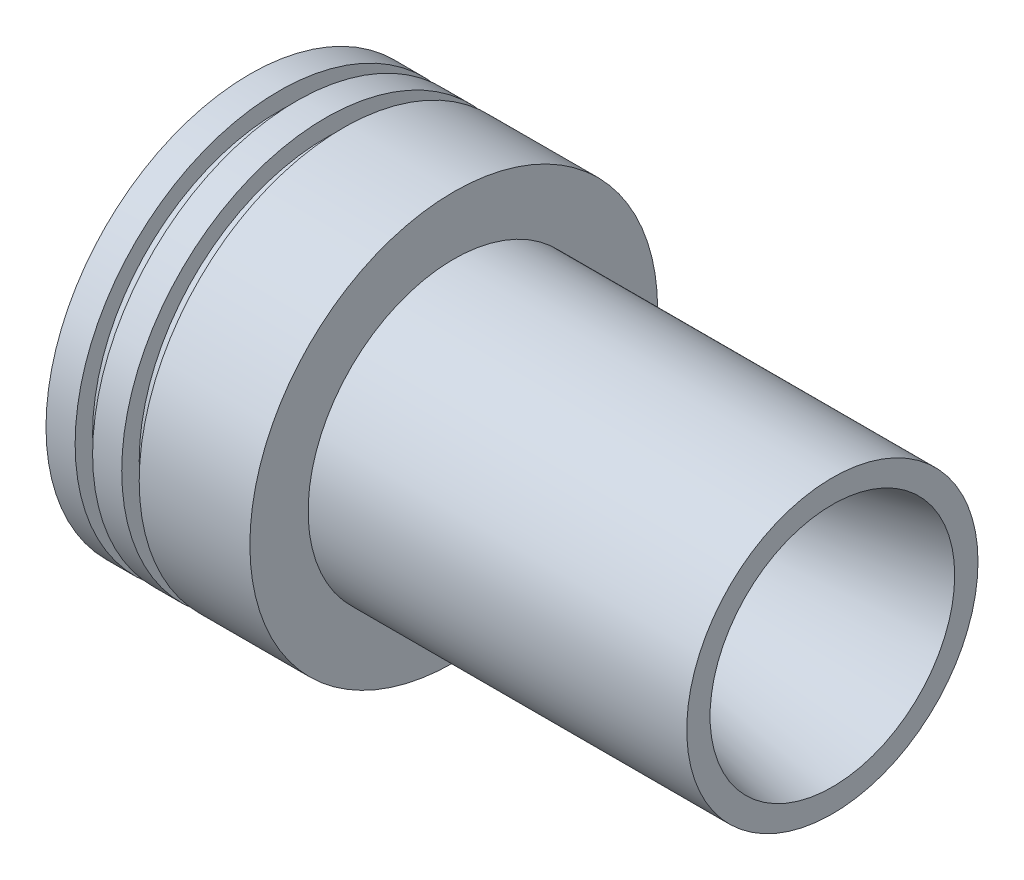
from build123d import *

# Parameters (mm, degrees)
SKETCH1_R           = 35
BOSS_EXTRUDE1_DEPTH = 35
SKETCH2_R           = 25
BOSS_EXTRUDE2_DEPTH = 65
SKETCH5_R           = 26
SKETCH7_R           = 6.5
SKETCH6_R           = 21
SKETCH8_R           = 6.5
SKETCH13_R          = 6.5
CUT_EXTRUDE2_DEPTH  = 100


with BuildPart() as part:
    # Sketch1 → Boss-Extrude1 (new body)
    with BuildSketch(Plane(origin=(0, 0, 0), x_dir=(0, 0, -1), z_dir=(1, 0, 0))):
        Circle(SKETCH1_R)
    extrude(amount=BOSS_EXTRUDE1_DEPTH)

    # Sketch2 → Boss-Extrude2 (add)
    with BuildSketch(Plane(origin=(35, 0, 0), x_dir=(0, 0, -1), z_dir=(1, 0, 0))):
        Circle(SKETCH2_R)
    extrude(amount=BOSS_EXTRUDE2_DEPTH)

    # Sketch5 → Cut-Loft1 section 0
    with BuildSketch(Plane.ZY):
        Circle(SKETCH5_R)
    # Sketch7 → Cut-Loft1 section 1
    with BuildSketch(Plane.ZY.offset(-30.8)):
        Circle(SKETCH7_R)
    loft(mode=Mode.SUBTRACT)

    # Sketch6 → Cut-Loft2 section 0
    with BuildSketch(Plane(origin=(100, 0, 0), x_dir=(0, 0, -1), z_dir=(1, 0, 0))):
        Circle(SKETCH6_R)
    # Sketch8 → Cut-Loft2 section 1
    with BuildSketch(Plane(origin=(31.8, 0, 0), x_dir=(0, 0, -1), z_dir=(1, 0, 0))):
        Circle(SKETCH8_R)
    loft(mode=Mode.SUBTRACT)

    # Sketch12 → Cut-Revolve1 (revolve, cut)
    with BuildSketch(Plane.XY, mode=Mode.PRIVATE) as cut_revolve1_sk:
        Polygon((0, 35), (5, 35), (5, 32), (8, 32), (8, 35), (13, 35), (13, 32), (16, 32), (16, 35), (16, 38.455510313), (0, 38.455510313), align=None)
    revolve(cut_revolve1_sk.sketch.rotate(Axis((0, 0, 0), (1, 0, 0)), 90), axis=Axis((0, 0, 0), (1, 0, 0)), mode=Mode.SUBTRACT)

    # Sketch13 → Cut-Extrude2 (cut)
    with BuildSketch(Plane.ZY):
        Circle(SKETCH13_R)
    extrude(amount=-CUT_EXTRUDE2_DEPTH, mode=Mode.SUBTRACT)


solid = part.part
